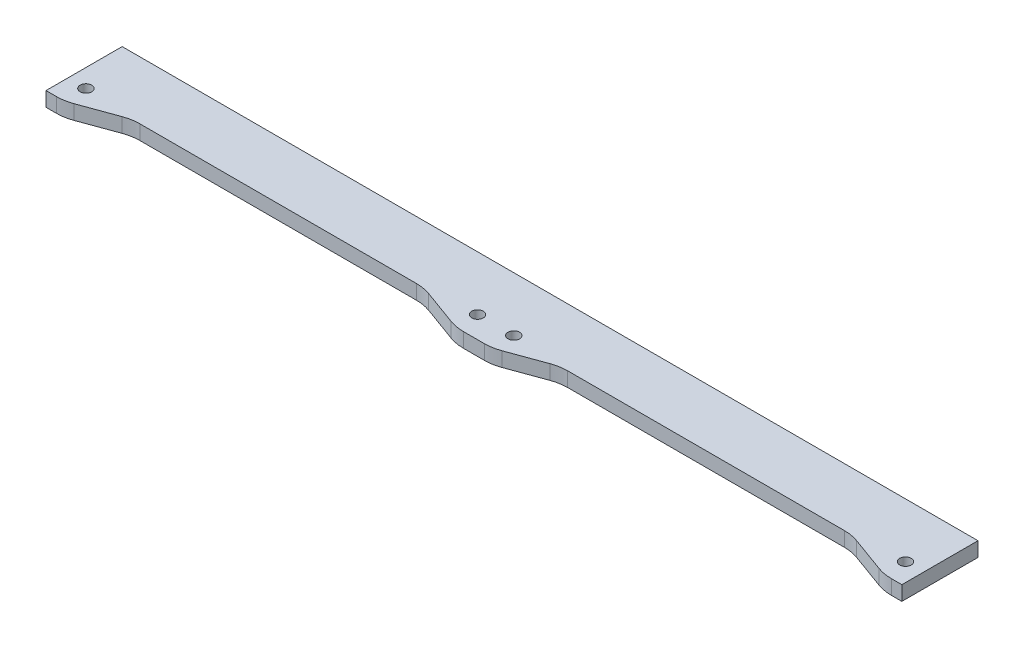
from build123d import *

# Parameters (mm, degrees)
SKETCH1_R           = 4
BOSS_EXTRUDE2_DEPTH = 10
FILLET1_R           = 30
FILLET2_R           = 30


with BuildPart() as part:
    # Sketch1 → Boss-Extrude2 (new body)
    with BuildSketch(Plane(origin=(0, 0, 0), x_dir=(1, 0, 0), z_dir=(0, 1, 0))):
        Polygon((12.5, -12.5), (46.843467743, 0), (248.156532257, 0), (282.5, -12.5), (307.5, -12.5), (341.843467743, 0), (543.156532257, 0), (577.5, -12.5), (590, -12.5), (590, 40), (0, 40), (0, -12.5), align=None)
        with Locations(Location((12.5, 2.5, 0), (0, 0, 270))):
            Circle(SKETCH1_R, mode=Mode.SUBTRACT)
        with Locations(Location((282.5, 2.5, 0), (0, 0, 270))):
            Circle(SKETCH1_R, mode=Mode.SUBTRACT)
        with Locations(Location((307.5, 2.5, 0), (0, 0, 270))):
            Circle(SKETCH1_R, mode=Mode.SUBTRACT)
        with Locations(Location((577.5, 2.5, 0), (0, 0, 270))):
            Circle(SKETCH1_R, mode=Mode.SUBTRACT)
    extrude(amount=BOSS_EXTRUDE2_DEPTH)

    # Fillet1
    fillet1_edges = [part.edges().sort_by_distance(p)[0] for p in [
        (46.843467743, 5, 0),
        (12.5, 5, 12.5),
    ]]
    fillet(fillet1_edges, radius=FILLET1_R)

    # Fillet2
    fillet2_edges = [part.edges().sort_by_distance(p)[0] for p in [
        (307.5, 5, 12.5),
        (282.5, 5, 12.5),
        (248.156532257, 5, 0),
        (577.5, 5, 12.5),
        (543.156532257, 5, 0),
        (341.843467743, 5, 0),
    ]]
    fillet(fillet2_edges, radius=FILLET2_R)


solid = part.part
